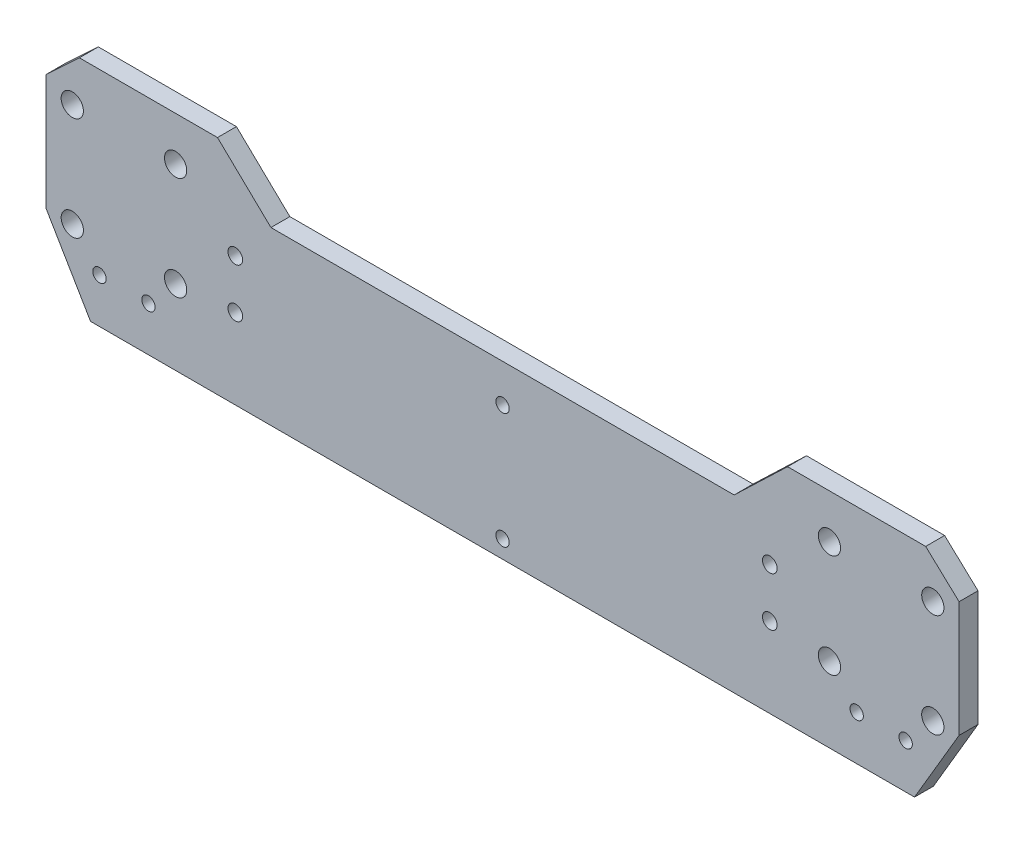
from build123d import *

# Parameters (mm, degrees)
SKETCH1_R           = 2.500008074
SKETCH1_R_2         = 2.499971378
SKETCH1_R_3         = 1.650003804
SKETCH1_R_4         = 1.64998699
SKETCH1_R_5         = 2.498738291
SKETCH1_R_6         = 2.499947604
SKETCH1_R_7         = 1.499976694
SKETCH1_R_8         = 1.500017827
SKETCH1_R_9         = 1.50001874
SKETCH1_R_10        = 1.499989662
BOSS_EXTRUDE1_DEPTH = 4.25


with BuildPart() as part:
    # Sketch1 → Boss-Extrude1 (new body)
    with BuildSketch(Plane.XY):
        Polygon((102.5, -33), (102.5, -7), (95, 0), (64, 0), (52, -11.5), (-52, -11.5), (-64, 0), (-95, 0), (-102.5, -7), (-102.5, -33), (-92.5, -50), (92.5, -50), align=None)
        with Locations((-96.600008074, -9.899995929)):
            Circle(SKETCH1_R, mode=Mode.SUBTRACT)
        with Locations((-73.4, -9.899975)):
            Circle(SKETCH1_R_2, mode=Mode.SUBTRACT)
        with Locations((-59.99995, -20.999975175)):
            Circle(SKETCH1_R_3, mode=Mode.SUBTRACT)
        with Locations((-59.99995, -32.000038683)):
            Circle(SKETCH1_R_4, mode=Mode.SUBTRACT)
        with Locations((-73.398707193, -33.112466424)):
            Circle(SKETCH1_R_5, mode=Mode.SUBTRACT)
        with Locations((-96.597049433, -33.113350272)):
            Circle(SKETCH1_R_6, mode=Mode.SUBTRACT)
        with Locations((-90.500019389, -40)):
            Circle(SKETCH1_R_7, mode=Mode.SUBTRACT)
        with Locations((-79.5, -40)):
            Circle(SKETCH1_R_8, mode=Mode.SUBTRACT)
        with Locations((0.003309528, -20.00748325)):
            Circle(SKETCH1_R_9, mode=Mode.SUBTRACT)
        with Locations((0.003345163, -46.007511034)):
            Circle(SKETCH1_R_10, mode=Mode.SUBTRACT)
        with Locations(Location((96.606599424, -9.899731124, 0), (0, 0, 180))):
            Circle(SKETCH1_R, mode=Mode.SUBTRACT)
        with Locations(Location((96.603704415, -33.113085476, 0), (0, 0, 180))):
            Circle(SKETCH1_R_6, mode=Mode.SUBTRACT)
        with Locations(Location((90.506693248, -39.999751917, 0), (0, 0, 180))):
            Circle(SKETCH1_R_7, mode=Mode.SUBTRACT)
        with Locations(Location((73.40659135, -9.899773791, 0), (0, 0, 180))):
            Circle(SKETCH1_R_2, mode=Mode.SUBTRACT)
        with Locations(Location((79.506673859, -39.999782069, 0), (0, 0, 180))):
            Circle(SKETCH1_R_8, mode=Mode.SUBTRACT)
        with Locations(Location((73.405362172, -33.112265218, 0), (0, 0, 180))):
            Circle(SKETCH1_R_5, mode=Mode.SUBTRACT)
        with Locations(Location((60.006571777, -20.999810697, 0), (0, 0, 180))):
            Circle(SKETCH1_R_3, mode=Mode.SUBTRACT)
        with Locations(Location((60.00660193, -31.999874205, 0), (0, 0, 180))):
            Circle(SKETCH1_R_4, mode=Mode.SUBTRACT)
    extrude(amount=BOSS_EXTRUDE1_DEPTH)


solid = part.part
